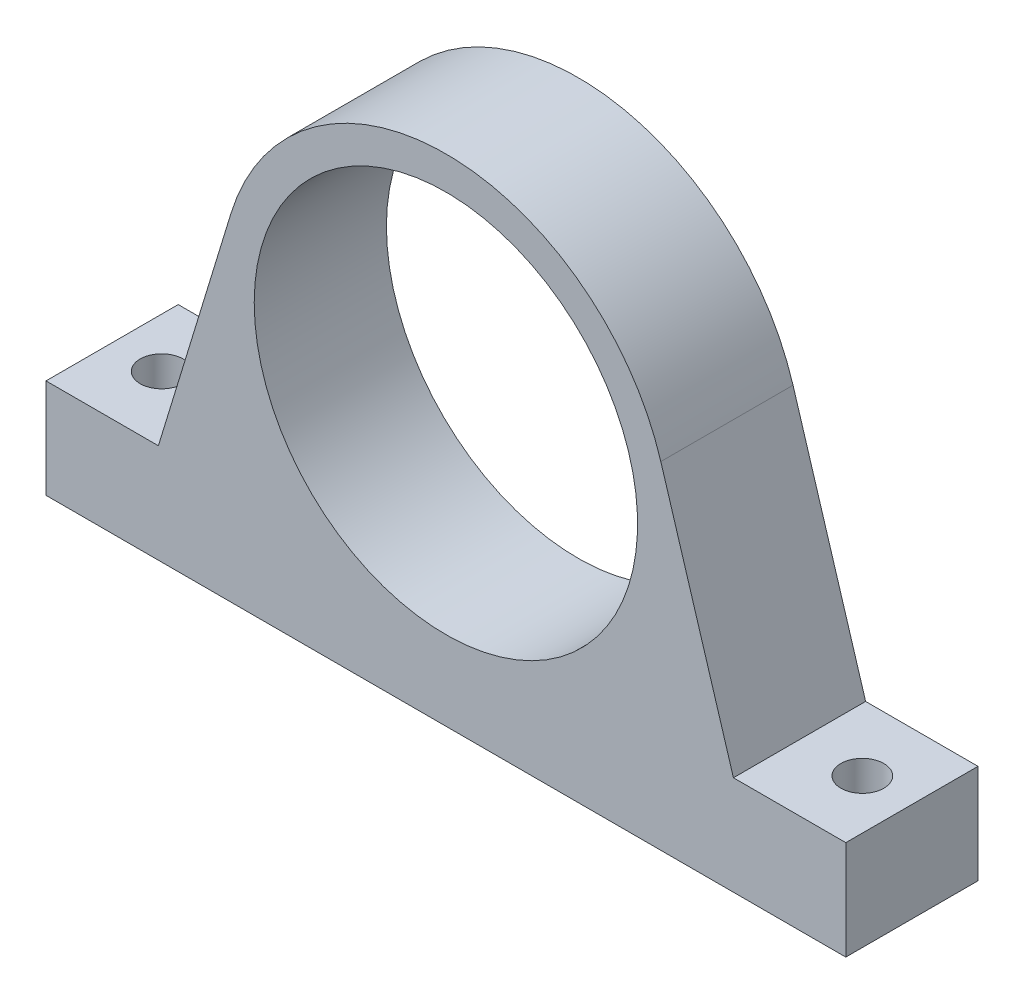
from build123d import *

# Parameters (mm, degrees)
BOSS_EXTRUDE1_DEPTH     = 20
CUT_EXTRUDE1_DEPTH      = 99.41366775
CUT_EXTRUDE1_DEPTH_BACK = 99.41366775
SKETCH2_R               = 29
SKETCH3_R               = 3.25
CUT_EXTRUDE2_DEPTH      = 88.522854158


with BuildPart() as part:
    # Sketch1 → Boss-Extrude1 (new body)
    with BuildSketch(Plane.XY):
        with BuildLine():
            Line((-60.5, 0), (60.5, 0))
            Line((60.5, 0), (60.5, 15))
            Line((60.5, 15), (43.5, 15))
            Line((43.5, 15), (32.514998433, 50.938555071))
            ThreePointArc((32.514998433, 50.938555071), (0, 75), (-32.514998433, 50.938555071))
            Line((-32.514998433, 50.938555071), (-43.5, 15))
            Line((-43.5, 15), (-60.5, 15))
            Line((-60.5, 15), (-60.5, 0))
        make_face()
    extrude(amount=BOSS_EXTRUDE1_DEPTH)

    # Sketch2 → Cut-Extrude1 (cut, two sides: drawn at the far end of the back side and taken through both)
    with BuildSketch(Plane(origin=(0, 0, 0), x_dir=(-1, 0, 0), z_dir=(0, 0, -1)).offset(-CUT_EXTRUDE1_DEPTH_BACK)):
        with Locations((0, 41)):
            Circle(SKETCH2_R)
    extrude(amount=CUT_EXTRUDE1_DEPTH + CUT_EXTRUDE1_DEPTH_BACK, mode=Mode.SUBTRACT)

    # Sketch3 → Cut-Extrude2 (cut, symmetric)
    with BuildSketch(Plane(origin=(0, 15, 0), x_dir=(1, 0, 0), z_dir=(0, 1, 0))):
        with Locations(Location((-53, -10, 0), (0, 0, 270))):
            Circle(SKETCH3_R)
    cut_extrude2 = extrude(amount=CUT_EXTRUDE2_DEPTH, both=True, mode=Mode.SUBTRACT)

    # Mirror1: Cut-Extrude2 across plane
    add(cut_extrude2.mirror(Plane(origin=(0, 0, 0), x_dir=(0, 0, 1), z_dir=(1, 0, 0))), mode=Mode.SUBTRACT)


solid = part.part
